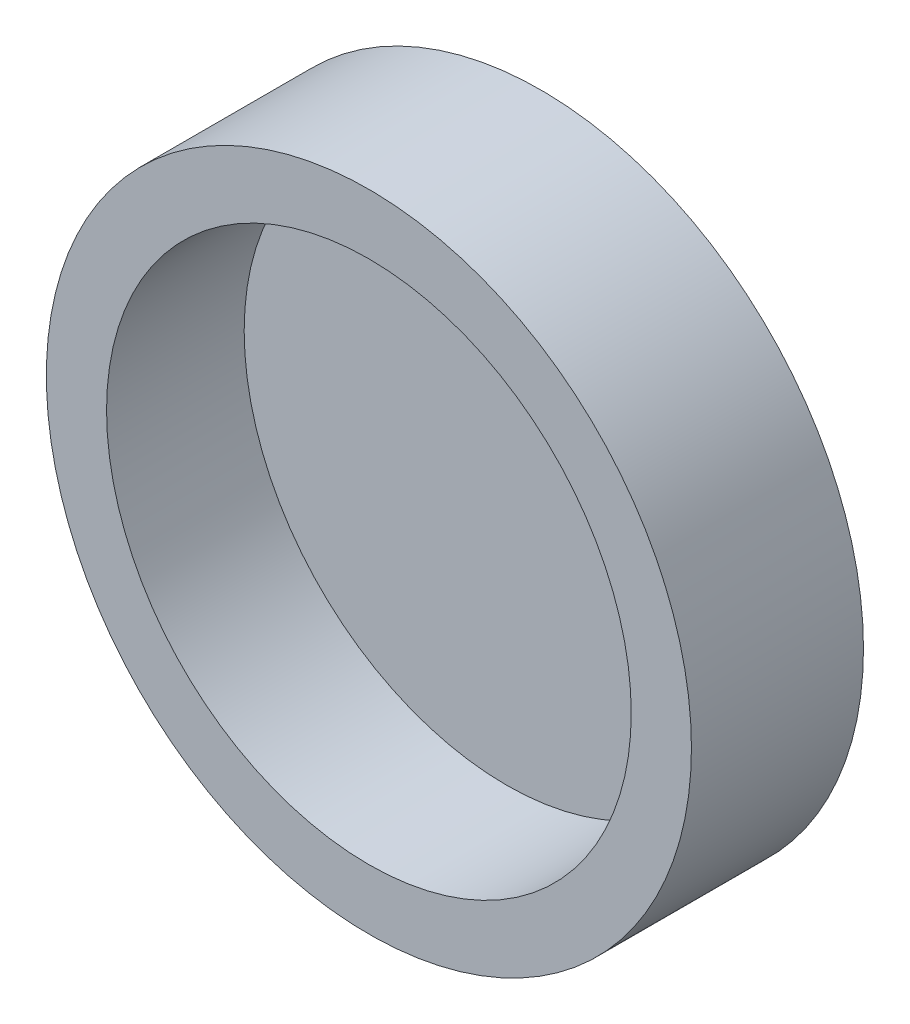
from build123d import *

# Parameters (mm, degrees)
SKETCH1_R           = 7.5
BOSS_EXTRUDE1_DEPTH = 4
SKETCH2_R           = 6.1
CUT_EXTRUDE1_DEPTH  = 3.2


with BuildPart() as part:
    # Sketch1 → Boss-Extrude1 (new body)
    with BuildSketch(Plane(origin=(0, 0, 0), x_dir=(0, 1, 0), z_dir=(0, 0, 1))):
        with Locations(Location((0, 0, 0), (0, 0, 270))):
            Circle(SKETCH1_R)
    extrude(amount=BOSS_EXTRUDE1_DEPTH)

    # Sketch2 → Cut-Extrude1 (cut)
    with BuildSketch(Plane.XY.offset(4)):
        Circle(SKETCH2_R)
    extrude(amount=-CUT_EXTRUDE1_DEPTH, mode=Mode.SUBTRACT)


solid = part.part
